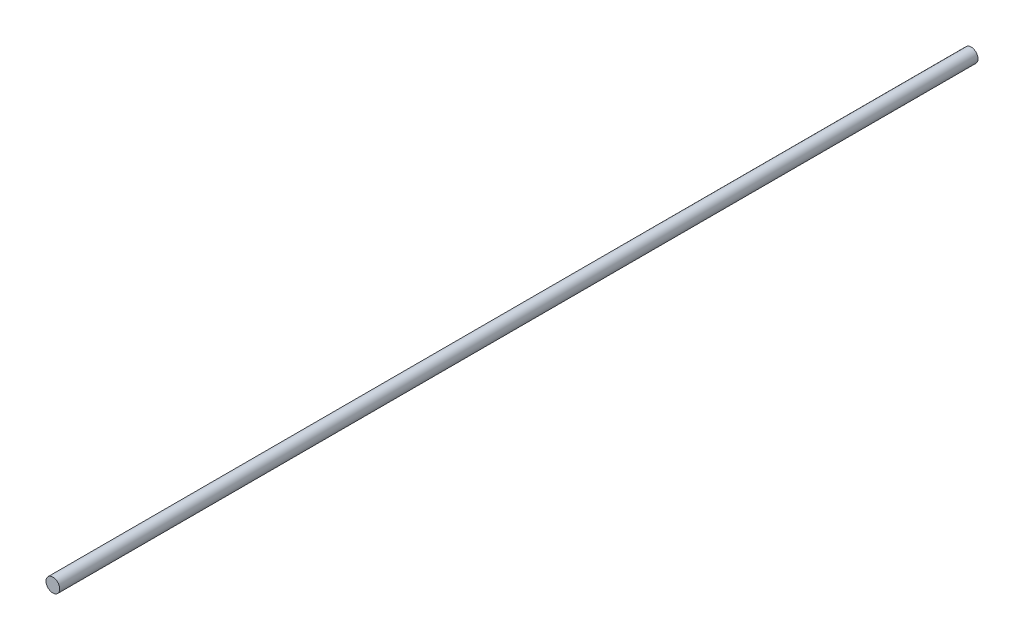
from build123d import *

# Parameters (mm, degrees)
SKETCH_1_R      = 7.5
EXTRUDE_1_DEPTH = 1000


with BuildPart() as part:
    # 草图1 → 凸台-拉伸1 (new body)
    with BuildSketch(Plane.XY):
        Circle(SKETCH_1_R)
    extrude(amount=EXTRUDE_1_DEPTH)


solid = part.part
